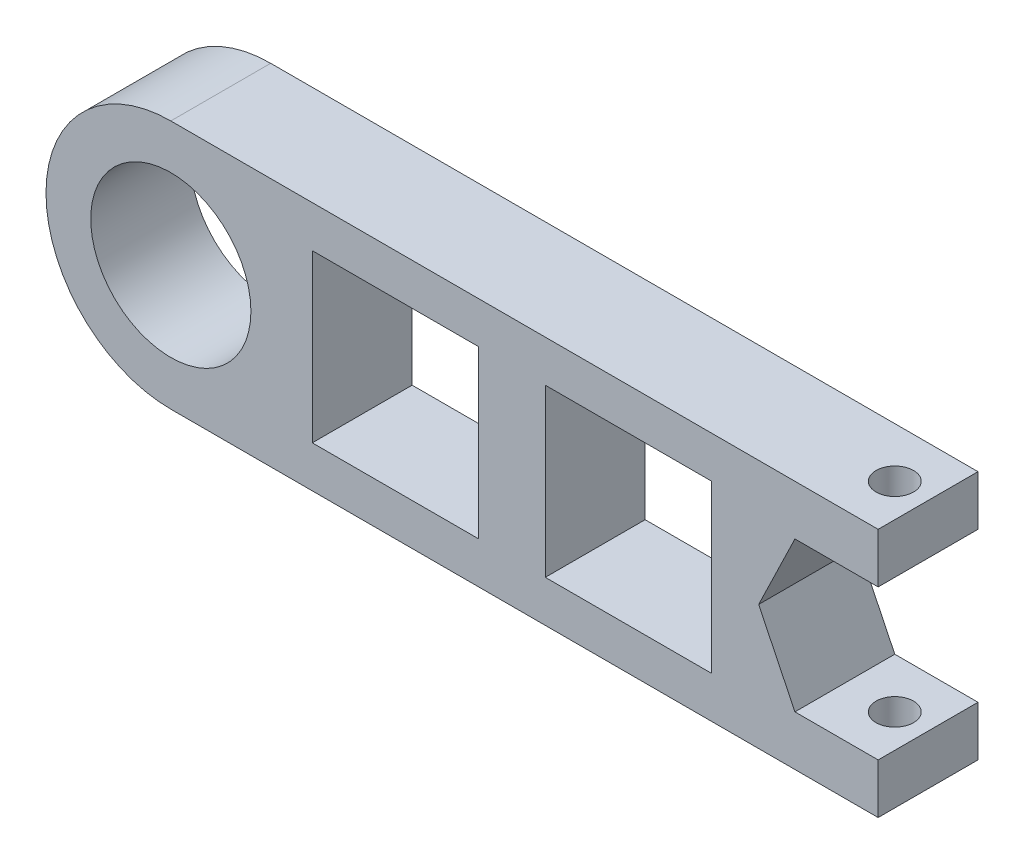
from build123d import *

# Parameters (mm, degrees)
SKETCH1_R           = 9.625
BOSS_EXTRUDE1_DEPTH = 12
SKETCH2_R           = 2.25
CUT_EXTRUDE1_DEPTH  = 106.090437243
SKETCH3_W           = 20
SKETCH3_H           = 20
CUT_EXTRUDE2_DEPTH  = 102.828286836


with BuildPart() as part:
    # Sketch1 → Boss-Extrude1 (new body)
    with BuildSketch(Plane.XY):
        with BuildLine():
            Line((-85, 15), (0, 15))
            Line((0, 15), (0, 9))
            Line((0, 9), (-10, 9))
            Line((-10, 9), (-14.358898944, 0))
            Line((-14.358898944, 0), (-10, -9))
            Line((-10, -9), (0, -9))
            Line((0, -9), (0, -15))
            Line((0, -15), (-85, -15))
            ThreePointArc((-85, -15), (-100, 0), (-85, 15))
        make_face()
        with Locations((-85, 0)):
            Circle(SKETCH1_R, mode=Mode.SUBTRACT)
    extrude(amount=BOSS_EXTRUDE1_DEPTH)

    # Sketch2 → Cut-Extrude1 (cut, through all)
    with BuildSketch(Plane.XZ.offset(15)):
        with Locations((-4, 6)):
            Circle(SKETCH2_R)
    extrude(amount=-CUT_EXTRUDE1_DEPTH, mode=Mode.SUBTRACT)

    # Sketch3 → Cut-Extrude2 (cut, through all)
    with BuildSketch(Plane.XY.offset(12)):
        with Locations((-30, 0)):
            Rectangle(SKETCH3_W, SKETCH3_H)
        with Locations((-58, 0)):
            Rectangle(SKETCH3_W, SKETCH3_H)
    extrude(amount=-CUT_EXTRUDE2_DEPTH, mode=Mode.SUBTRACT)


solid = part.part
